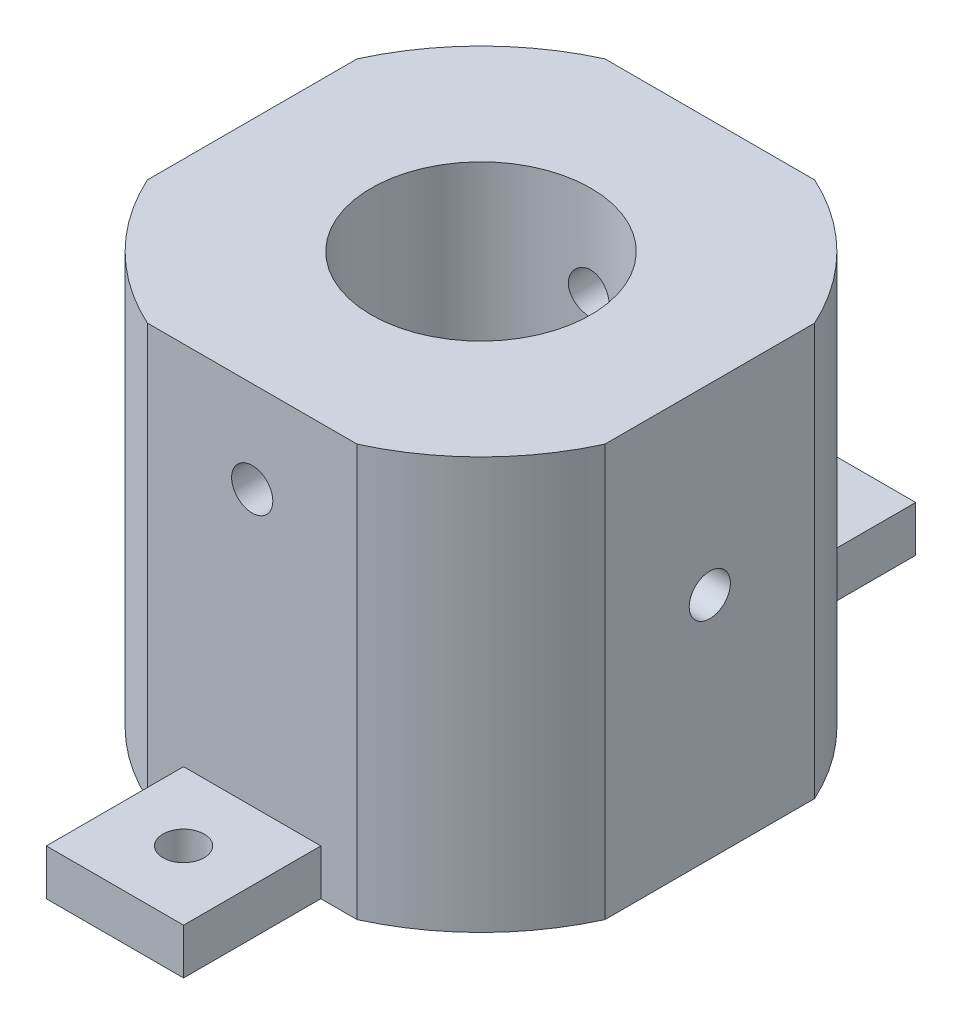
from build123d import *

# Parameters (mm, degrees)
BOSS_EXTRUDE1_DEPTH            = 45
SKETCH2_W                      = 15
SKETCH2_H                      = 5
BOSS_EXTRUDE2_DEPTH            = 15
SKETCH3_W                      = 15
SKETCH3_H                      = 5
BOSS_EXTRUDE3_DEPTH            = 15
F_24_0_24_DIAMETER_HOLE1_D     = 24
F_4_5_4_5_DIAMETER_HOLE1_D     = 4.5
F_4_5_4_5_DIAMETER_HOLE1_DEPTH = 63.212824766
F_4_5_4_5_DIAMETER_HOLE2_D     = 4.5
F_4_5_4_5_DIAMETER_HOLE2_DEPTH = 63.212824766
F_4_5_4_5_DIAMETER_HOLE3_D     = 4.5


with BuildPart() as part:
    # Sketch1 → Boss-Extrude1 (new body)
    with BuildSketch(Plane.XZ):
        with BuildLine():
            Line((-11.456439237, -25), (11.456439237, -25))
            ThreePointArc((11.456439237, -25), (19.445436483, -19.445436483), (25, -11.456439237))
            Line((25, -11.456439237), (25, 11.456439237))
            ThreePointArc((25, 11.456439237), (19.445436483, 19.445436483), (11.456439237, 25))
            Line((11.456439237, 25), (-11.456439237, 25))
            ThreePointArc((-11.456439237, 25), (-19.445436483, 19.445436483), (-25, 11.456439237))
            Line((-25, 11.456439237), (-25, -11.456439237))
            ThreePointArc((-25, -11.456439237), (-19.445436483, -19.445436483), (-11.456439237, -25))
        make_face()
    extrude(amount=-BOSS_EXTRUDE1_DEPTH)

    # Sketch2 → Boss-Extrude2 (add)
    with BuildSketch(Plane(origin=(0, 0, -25), x_dir=(-1, 0, 0), z_dir=(0, 0, -1))):
        with Locations((0, 2.5)):
            Rectangle(SKETCH2_W, SKETCH2_H)
    extrude(amount=BOSS_EXTRUDE2_DEPTH)

    # Sketch3 → Boss-Extrude3 (add)
    with BuildSketch(Plane.XY.offset(25)):
        with Locations((0, 2.5)):
            Rectangle(SKETCH3_W, SKETCH3_H)
    extrude(amount=BOSS_EXTRUDE3_DEPTH)

    # Ø24.0 (24) Diameter Hole1 (through all)
    with Locations(Plane(origin=(0, 0, 0), x_dir=(-1, 0, 0), z_dir=(0, -1, 0))):
        with Locations((0, 0)):
            Hole(F_24_0_24_DIAMETER_HOLE1_D / 2)

    # Ø4.5 (4.5) Diameter Hole1
    with Locations(Plane(origin=(0, 0, -25), x_dir=(-1, 0, 0), z_dir=(0, 0, -1))):
        with Locations((0, 35)):
            Hole(F_4_5_4_5_DIAMETER_HOLE1_D / 2, depth=F_4_5_4_5_DIAMETER_HOLE1_DEPTH)

    # Ø4.5 (4.5) Diameter Hole2
    with Locations(Plane.ZY.offset(25)):
        with Locations((0, 25)):
            Hole(F_4_5_4_5_DIAMETER_HOLE2_D / 2, depth=F_4_5_4_5_DIAMETER_HOLE2_DEPTH)

    # Ø4.5 (4.5) Diameter Hole3 (through all)
    with Locations(Plane(origin=(0, 5, 0), x_dir=(1, 0, 0), z_dir=(0, 1, 0))):
        with Locations((0, -32.5), (0, 32.5)):
            Hole(F_4_5_4_5_DIAMETER_HOLE3_D / 2)


solid = part.part
